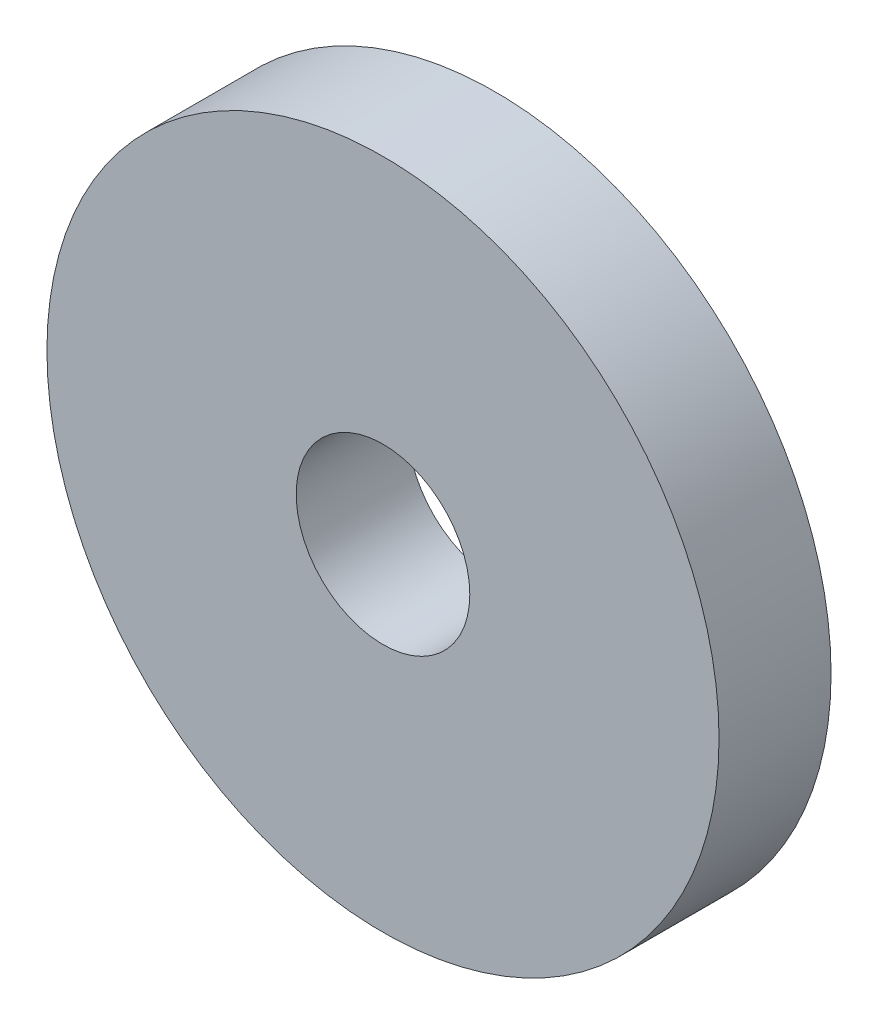
from build123d import *

# Parameters (mm, degrees)
SKETCH_1_R      = 6
SKETCH_1_R_2    = 1.55
EXTRUDE_1_DEPTH = 2


with BuildPart() as part:
    # 草图1 → 凸台-拉伸1 (new body)
    with BuildSketch(Plane.XY):
        Circle(SKETCH_1_R)
        Circle(SKETCH_1_R_2, mode=Mode.SUBTRACT)
    extrude(amount=EXTRUDE_1_DEPTH)


solid = part.part
